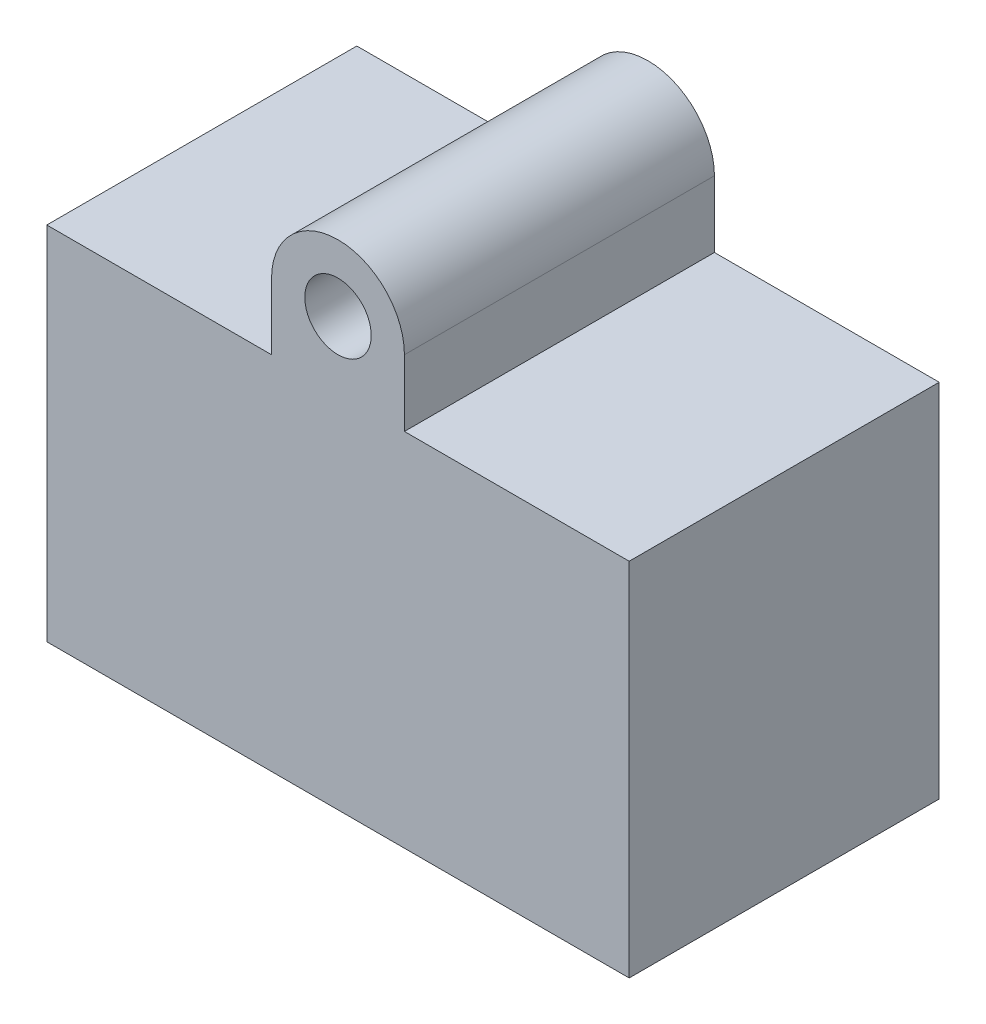
from build123d import *

# Parameters (mm, degrees)
SKETCH1_R           = 0.75
SKETCH1_W           = 10.15
SKETCH1_H           = 5.15
BOSS_EXTRUDE1_DEPTH = 7
SKETCH2_W           = 13.15
SKETCH2_H           = 8.15
BOSS_EXTRUDE2_DEPTH = 2


with BuildPart() as part:
    # Sketch1 → Boss-Extrude1 (new body)
    with BuildSketch(Plane.XY):
        with BuildLine():
            Line((-6.58, 4.075), (-1.505, 4.075))
            Line((-1.505, 4.075), (-1.505, 5.575))
            ThreePointArc((-1.505, 5.575), (-0.005, 7.075), (1.495, 5.575))
            Line((1.495, 5.575), (1.495, 4.075))
            Line((1.495, 4.075), (6.57, 4.075))
            Line((6.57, 4.075), (6.57, -4.075))
            Line((6.57, -4.075), (-6.58, -4.075))
            Line((-6.58, -4.075), (-6.58, 4.075))
        make_face()
        with Locations((-0.005, 5.575)):
            Circle(SKETCH1_R, mode=Mode.SUBTRACT)
        with Locations((-0.005, 0)):
            Rectangle(SKETCH1_W, SKETCH1_H, mode=Mode.SUBTRACT)
    extrude(amount=BOSS_EXTRUDE1_DEPTH)

    # Sketch2 → Boss-Extrude2 (add)
    with BuildSketch(Plane.XY.offset(7)):
        with Locations((-0.005, 0)):
            Rectangle(SKETCH2_W, SKETCH2_H)
    extrude(amount=-BOSS_EXTRUDE2_DEPTH)


solid = part.part
